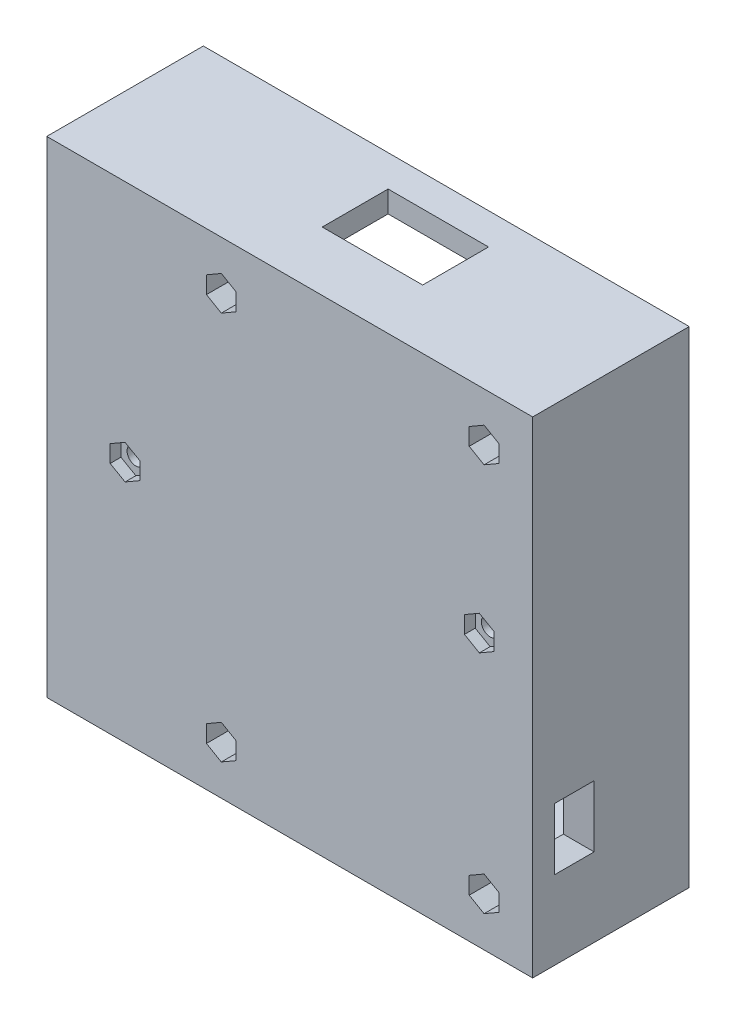
from build123d import *

# Parameters (mm, degrees)
CROQUIS1_W              = 90
CROQUIS1_H              = 90
SALIENTE_EXTRUIR1_DEPTH = 4
CROQUIS2_W              = 90
CROQUIS2_H              = 90
SALIENTE_EXTRUIR2_DEPTH = 25
CORTAR_EXTRUIR1_DEPTH   = 4
CORTAR_EXTRUIR1_DRAFT   = -23
CROQUIS6_W              = 10
CROQUIS6_H              = 10
SALIENTE_EXTRUIR4_DEPTH = 4
CORTAR_EXTRUIR2_START   = -8
CROQUIS7_R              = 1.625
CORTAR_EXTRUIR2_DEPTH   = 8
CORTAR_EXTRUIR3_DEPTH   = 6
CROQUIS9_R              = 1.625
CORTAR_EXTRUIR4_DEPTH   = 4
CORTAR_EXTRUIR5_DEPTH   = 2
CORTAR_EXTRUIR6_DEPTH   = 6
CROQUIS14_W             = 18.6
CROQUIS14_H             = 12.2
CORTAR_EXTRUIR7_DEPTH   = 4


with BuildPart() as part:
    # Croquis1 → Saliente-Extruir1 (new body)
    with BuildSketch(Plane.XY):
        with Locations((0.511455403, -1.711718513)):
            Rectangle(CROQUIS1_W, CROQUIS1_H)
    extrude(amount=SALIENTE_EXTRUIR1_DEPTH)

    # Croquis2 → Saliente-Extruir2 (add)
    with BuildSketch(Plane(origin=(0, 0, 0), x_dir=(-1, 0, 0), z_dir=(0, 0, -1))):
        with Locations((-0.511455403, -1.711718513)):
            Rectangle(CROQUIS2_W, CROQUIS2_H)
        Polygon((40.488544597, -27.157447779), (40.488544597, -42.711718513), (-41.511455403, -42.711718513), (-41.511455403, 39.288281487), (40.488544597, 39.288281487), align=None, mode=Mode.SUBTRACT)
    extrude(amount=SALIENTE_EXTRUIR2_DEPTH)


with BuildPart() as cortar_extruir1_tool:
    # Croquis4 → Cortar-Extruir1 (with draft: the straight prism first)
    with BuildSketch(Plane(origin=(45.511455403, 0, 0), x_dir=(0, 0, -1), z_dir=(1, 0, 0))):
        Polygon((0, -21.474747311), (0, -31.451823221), (0, -32.175243971), (7.383420942, -32.175243971), (7.383420942, -31.451823221), (7.383420942, -21.474747311), (7.383420942, -20.751326561), (0, -20.751326561), align=None)
    extrude(amount=-CORTAR_EXTRUIR1_DEPTH)
    # Cortar-Extruir1: the draft: its side faces are tilted about the plane it starts from
    cortar_extruir1_sides = [cortar_extruir1_tool.faces().sort_by_distance(p)[0] for p in [
        (43.511455403, -26.463285266, 0),
        (43.511455403, -26.463285266, -7.383420942),
        (43.511455403, -32.175243971, -3.691710471),
        (43.511455403, -20.751326561, -3.691710471),
    ]]
    draft(cortar_extruir1_sides, Plane(origin=(45.511455403, 0, 0), x_dir=(0, 0, -1), z_dir=(1, 0, 0)), CORTAR_EXTRUIR1_DRAFT)


with BuildPart() as part_1:
    add(part.part)

    # Cortar-Extruir1: cut by cortar_extruir1_tool
    add(cortar_extruir1_tool.part, mode=Mode.SUBTRACT)

    # Croquis6 → Saliente-Extruir4 (add)
    with BuildSketch(Plane(origin=(0, 0, 0), x_dir=(-1, 0, 0), z_dir=(0, 0, -1))):
        with Locations((-36.511455403, 34.288281487)):
            Rectangle(CROQUIS6_W, CROQUIS6_H)
        with Locations((-36.511455403, -37.711718513)):
            Rectangle(CROQUIS6_W, CROQUIS6_H)
        with Locations((12.157098337, -37.711718513)):
            Rectangle(CROQUIS6_W, CROQUIS6_H)
        with Locations((12.157098337, 34.288281487)):
            Rectangle(CROQUIS6_W, CROQUIS6_H)
    extrude(amount=SALIENTE_EXTRUIR4_DEPTH)

    # Croquis7 → Cortar-Extruir2 (cut)
    with BuildSketch(Plane(origin=(0, 0, -4), x_dir=(-1, 0, 0), z_dir=(0, 0, -1)).offset(CORTAR_EXTRUIR2_START)):
        with Locations((-36.511455403, 34.288281487)):
            Circle(CROQUIS7_R)
        with Locations((-36.511455403, -37.711718513)):
            Circle(CROQUIS7_R)
        with Locations((12.157098337, -37.711718513)):
            Circle(CROQUIS7_R)
        with Locations((12.157098337, 34.288281487)):
            Circle(CROQUIS7_R)
    extrude(amount=CORTAR_EXTRUIR2_DEPTH, mode=Mode.SUBTRACT)

    # Croquis8 → Cortar-Extruir3 (cut)
    with BuildSketch(Plane.XY.offset(4)):
        Polygon((36.511455403, -40.891718513), (39.265416187, -39.301718513), (39.265416187, -36.121718513), (36.511455403, -34.531718513), (33.757494619, -36.121718513), (33.757494619, -39.301718513), align=None)
        Polygon((36.511455403, 31.108281487), (39.265416187, 32.698281487), (39.265416187, 35.878281487), (36.511455403, 37.468281487), (33.757494619, 35.878281487), (33.757494619, 32.698281487), align=None)
    extrude(amount=-CORTAR_EXTRUIR3_DEPTH, mode=Mode.SUBTRACT)

    # Croquis9 → Cortar-Extruir4 (cut)
    with BuildSketch(Plane(origin=(0, 0, 0), x_dir=(-1, 0, 0), z_dir=(0, 0, -1))):
        with Locations((-35.631455403, 3.678281487)):
            Circle(CROQUIS9_R)
        with Locations((29.988544597, -1.711718513)):
            Circle(CROQUIS9_R)
    extrude(amount=-CORTAR_EXTRUIR4_DEPTH, mode=Mode.SUBTRACT)

    # Croquis10 → Cortar-Extruir5 (cut)
    with BuildSketch(Plane.XY.offset(4)):
        Polygon((-29.988544597, -4.891718513), (-27.234583813, -3.301718513), (-27.234583813, -0.121718513), (-29.988544597, 1.468281487), (-32.742505381, -0.121718513), (-32.742505381, -3.301718513), align=None)
        Polygon((35.631455403, 0.498281487), (38.385416187, 2.088281487), (38.385416187, 5.268281487), (35.631455403, 6.858281487), (32.877494619, 5.268281487), (32.877494619, 2.088281487), align=None)
    extrude(amount=-CORTAR_EXTRUIR5_DEPTH, mode=Mode.SUBTRACT)

    # Croquis11 → Cortar-Extruir6 (cut)
    with BuildSketch(Plane.XY.offset(4)):
        Polygon((-12.157098337, 31.108281487), (-9.403137553, 32.698281487), (-9.403137553, 35.878281487), (-12.157098337, 37.468281487), (-14.911059122, 35.878281487), (-14.911059122, 32.698281487), align=None)
        Polygon((-12.157098337, -34.531718513), (-14.911059122, -36.121718513), (-14.911059122, -39.301718513), (-12.157098337, -40.891718513), (-9.403137553, -39.301718513), (-9.403137553, -36.121718513), align=None)
    extrude(amount=-CORTAR_EXTRUIR6_DEPTH, mode=Mode.SUBTRACT)

    # Croquis14 → Cortar-Extruir7 (cut)
    with BuildSketch(Plane(origin=(0, 43.288281487, 0), x_dir=(1, 0, 0), z_dir=(0, 1, 0))):
        with Locations((4.864130661, 13.073723415)):
            Rectangle(CROQUIS14_W, CROQUIS14_H)
    extrude(amount=-CORTAR_EXTRUIR7_DEPTH, mode=Mode.SUBTRACT)


solid = part_1.part
